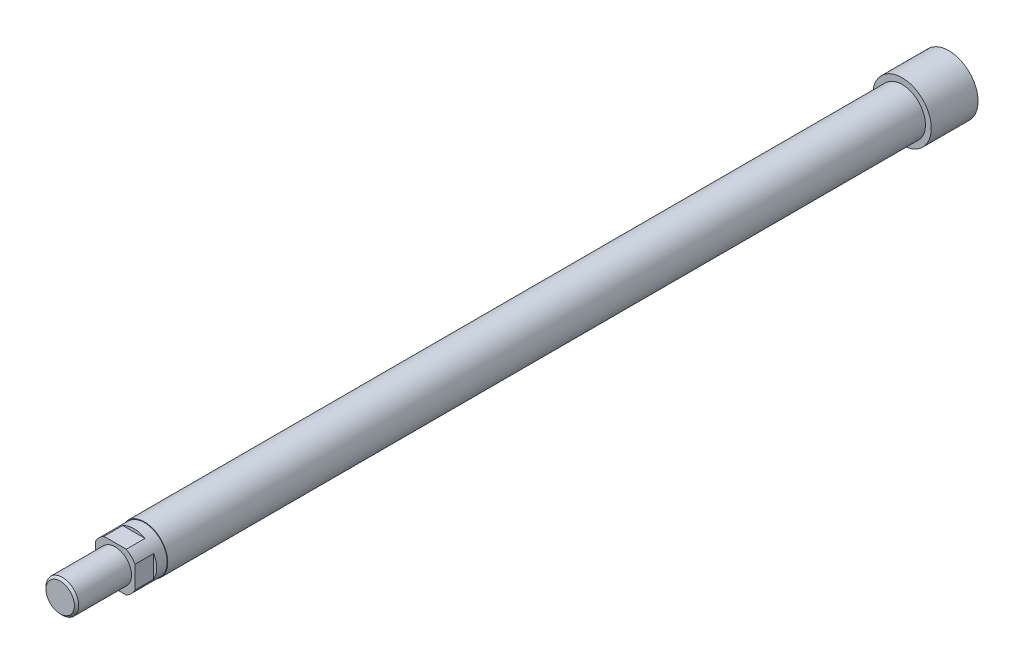
from build123d import *

# Parameters (mm, degrees)
SKETCH1_W           = 12.5
SKETCH1_H           = 20
SKETCH2_R           = 10
BOSS_EXTRUDE1_DEPTH = 324
SKETCH3_R           = 9.75
BOSS_EXTRUDE2_DEPTH = 12.5
CUT_EXTRUDE1_START  = -8
CUT_EXTRUDE1_DEPTH  = 8
CUT_EXTRUDE2_START  = -8
CUT_EXTRUDE2_DEPTH  = 8
CUT_EXTRUDE3_START  = -8
CUT_EXTRUDE3_DEPTH  = 8
CUT_EXTRUDE4_START  = -8
CUT_EXTRUDE4_DEPTH  = 8
SKETCH8_R           = 7
BOSS_EXTRUDE3_DEPTH = 23.5
CHAMFER1_SIZE       = 0.92


with BuildPart() as part:
    # Sketch1 → Revolve1 (revolve)
    with BuildSketch(Plane.XZ, mode=Mode.PRIVATE) as revolve1_sk:
        with Locations((6.25, -332)):
            Rectangle(SKETCH1_W, SKETCH1_H)
    revolve(revolve1_sk.sketch.rotate(Axis((0, 0, -322), (0, 0, -1)), 180), axis=Axis((0, 0, -322), (0, 0, -1)))

    # Sketch2 → Boss-Extrude1 (add)
    with BuildSketch(Plane.XY.offset(-322)):
        Circle(SKETCH2_R)
    extrude(amount=BOSS_EXTRUDE1_DEPTH)

    # Sketch3 → Boss-Extrude2 (add)
    with BuildSketch(Plane.XY.offset(2)):
        Circle(SKETCH3_R)
    extrude(amount=BOSS_EXTRUDE2_DEPTH)

    # Sketch4 → Cut-Extrude1 (cut)
    with BuildSketch(Plane.XY.offset(14.5).offset(CUT_EXTRUDE1_START)):
        with BuildLine():
            Line((-8.5, -4.776243294), (-8.5, 4.776243294))
            ThreePointArc((-8.5, 4.776243294), (-9.75, 0), (-8.5, -4.776243294))
        make_face()
    extrude(amount=CUT_EXTRUDE1_DEPTH, mode=Mode.SUBTRACT)

    # Sketch5 → Cut-Extrude2 (cut)
    with BuildSketch(Plane.XY.offset(14.5).offset(CUT_EXTRUDE2_START)):
        with BuildLine():
            Line((4.776243294, -8.5), (-4.776243294, -8.5))
            ThreePointArc((-4.776243294, -8.5), (0, -9.75), (4.776243294, -8.5))
        make_face()
    extrude(amount=CUT_EXTRUDE2_DEPTH, mode=Mode.SUBTRACT)

    # Sketch6 → Cut-Extrude3 (cut)
    with BuildSketch(Plane.XY.offset(14.5).offset(CUT_EXTRUDE3_START)):
        with BuildLine():
            Line((8.5, 4.776243294), (8.5, -4.776243294))
            ThreePointArc((8.5, -4.776243294), (9.75, 0), (8.5, 4.776243294))
        make_face()
    extrude(amount=CUT_EXTRUDE3_DEPTH, mode=Mode.SUBTRACT)

    # Sketch7 → Cut-Extrude4 (cut)
    with BuildSketch(Plane.XY.offset(14.5).offset(CUT_EXTRUDE4_START)):
        with BuildLine():
            Line((-4.776243294, 8.5), (4.776243294, 8.5))
            ThreePointArc((4.776243294, 8.5), (0, 9.75), (-4.776243294, 8.5))
        make_face()
    extrude(amount=CUT_EXTRUDE4_DEPTH, mode=Mode.SUBTRACT)

    # Sketch8 → Boss-Extrude3 (add)
    with BuildSketch(Plane.XY.offset(14.5)):
        Circle(SKETCH8_R)
    extrude(amount=BOSS_EXTRUDE3_DEPTH)

    # Chamfer1
    chamfer1_edges = [part.edges().sort_by_distance(p)[0] for p in [
        (-7, 0, 38),
    ]]
    chamfer(chamfer1_edges, length=CHAMFER1_SIZE)


solid = part.part
